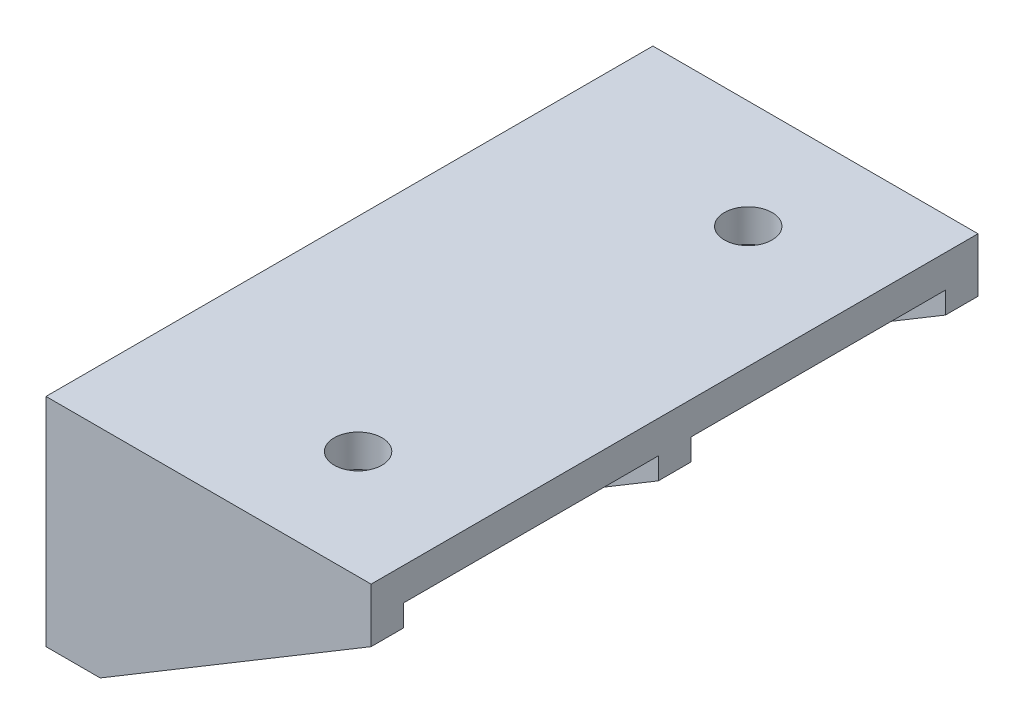
from build123d import *

# Parameters (mm, degrees)
EXTRUDE_1_DEPTH     = 28
EXTRUDE_START       = 28
EXTRUDE_2_DEPTH     = 3
EXTRUDE_3_DEPTH     = 1.5
EXTRUDE_START_2     = -28
EXTRUDE_4_DEPTH     = 3
CUT_EXTRUDE_1_REACH = 47.651
SKETCH_3_R          = 2.2
CUT_EXTRUDE_2_REACH = 47.651
SKETCH_4_R          = 1.7


with BuildPart() as part:
    # 草图1 → 凸台-拉伸1 (new, symmetric)
    with BuildSketch(Plane.XY):
        Polygon((0, 0), (0, 20), (30, 20), (30, 17), (3, 17), (3, 0), align=None)
    extrude(amount=EXTRUDE_1_DEPTH, both=True)

    # 草图2 → 凸台-拉伸2 (add)
    with BuildSketch(Plane.XY.offset(EXTRUDE_START)):
        Polygon((3, 0), (5, 0), (30, 15), (30, 17), (3, 17), align=None)
    extrude(amount=-EXTRUDE_2_DEPTH)

    # 草图2<2> → 凸台-拉伸3 (add, symmetric)
    with BuildSketch(Plane.XY):
        Polygon((3, 0), (5, 0), (30, 15), (30, 17), (3, 17), align=None)
    extrude(amount=EXTRUDE_3_DEPTH, both=True)

    # 草图2<3> → 凸台-拉伸4 (add)
    with BuildSketch(Plane.XY.offset(EXTRUDE_START_2)):
        Polygon((3, 0), (5, 0), (30, 15), (30, 17), (3, 17), align=None)
    extrude(amount=EXTRUDE_4_DEPTH)

    # 草图3 → 切除-拉伸1 (cut, up to next)
    with BuildSketch(Plane(origin=(0, 0, 0), x_dir=(1, 0, 0), z_dir=(0, 1, 0)), mode=Mode.PRIVATE) as cut_extrude_1_sk1:
        with Locations(Location((18.8, 18, 0), (0, 0, 90))):
            Circle(SKETCH_3_R)
    cut_extrude_1_tool1 = extrude(cut_extrude_1_sk1.sketch, amount=CUT_EXTRUDE_1_REACH, mode=Mode.PRIVATE) & part.part
    # 草图3 → 切除-拉伸1 (cut, up to next)
    with BuildSketch(Plane(origin=(0, 0, 0), x_dir=(1, 0, 0), z_dir=(0, 1, 0)), mode=Mode.PRIVATE) as cut_extrude_1_sk2:
        with Locations(Location((18.8, -18, 0), (0, 0, 90))):
            Circle(SKETCH_3_R)
    cut_extrude_1_tool2 = extrude(cut_extrude_1_sk2.sketch, amount=CUT_EXTRUDE_1_REACH, mode=Mode.PRIVATE) & part.part
    add(cut_extrude_1_tool1.solids().sort_by_distance((18.8, 0, -18))[0], mode=Mode.SUBTRACT)
    add(cut_extrude_1_tool2.solids().sort_by_distance((18.8, 0, 18))[0], mode=Mode.SUBTRACT)

    # 草图4 → 切除-拉伸2 (cut, up to next)
    with BuildSketch(Plane(origin=(0, 0, 0), x_dir=(0, 0, -1), z_dir=(1, 0, 0)), mode=Mode.PRIVATE) as cut_extrude_2_sk1:
        with Locations(Location((-18, 10, 0), (0, 0, 180))):
            Circle(SKETCH_4_R)
    cut_extrude_2_tool1 = extrude(cut_extrude_2_sk1.sketch, amount=CUT_EXTRUDE_2_REACH, mode=Mode.PRIVATE) & part.part
    # 草图4 → 切除-拉伸2 (cut, up to next)
    with BuildSketch(Plane(origin=(0, 0, 0), x_dir=(0, 0, -1), z_dir=(1, 0, 0)), mode=Mode.PRIVATE) as cut_extrude_2_sk2:
        with Locations(Location((18, 10, 0), (0, 0, 180))):
            Circle(SKETCH_4_R)
    cut_extrude_2_tool2 = extrude(cut_extrude_2_sk2.sketch, amount=CUT_EXTRUDE_2_REACH, mode=Mode.PRIVATE) & part.part
    add(cut_extrude_2_tool1.solids().sort_by_distance((0, 10, 18))[0], mode=Mode.SUBTRACT)
    add(cut_extrude_2_tool2.solids().sort_by_distance((0, 10, -18))[0], mode=Mode.SUBTRACT)


solid = part.part
